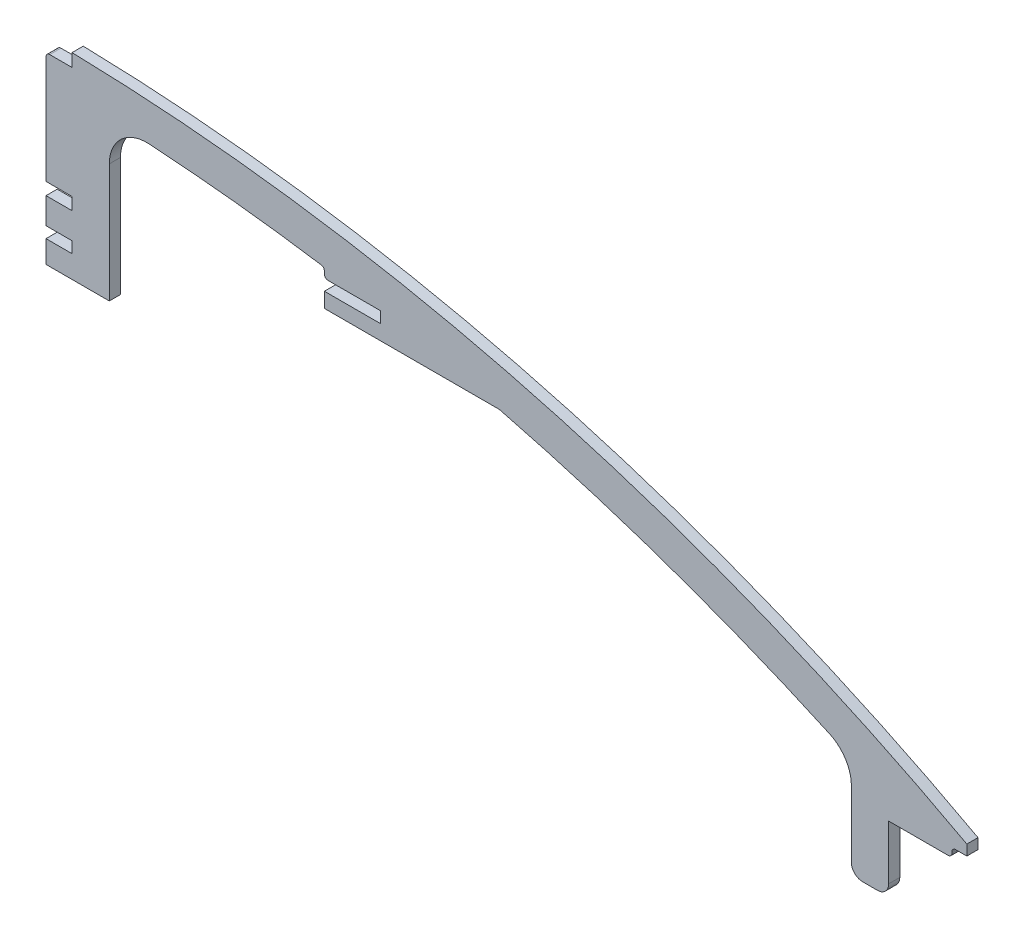
from build123d import *

# Parameters (mm, degrees)
BOSS_EXTRUDE1_DEPTH = 1.5
SKETCH4_W           = 2
SKETCH4_H           = 7.019019915
CUT_EXTRUDE2_DEPTH  = 3


with BuildPart() as part:
    # Sketch2 → Boss-Extrude1 (new, symmetric)
    with BuildSketch(Plane.XY):
        with BuildLine():
            Line((294.5, -67.353443934), (299.5, -67.353443934))
            Line((299.5, -67.353443934), (299.5, -65.649534053))
            ThreePointArc((299.5, -65.649534053), (182.278534334, -18.599191723), (57.25, -0.641677179))
            Line((57.25, -0.641677179), (57.25, -4.102198064))
            Line((57.25, -4.102198064), (51.25, -4.102198064))
            ThreePointArc((51.25, -4.102198064), (50.542893219, -4.395091282), (50.25, -5.102198064))
            Line((50.25, -5.102198064), (50.25, -34.102198064))
            Line((50.25, -34.102198064), (57.25, -34.102198064))
            Line((57.25, -34.102198064), (57.25, -37.402198064))
            Line((57.25, -37.402198064), (50.25, -37.402198064))
            Line((50.25, -37.402198064), (50.25, -44.402198064))
            Line((50.25, -44.402198064), (57.25, -44.402198064))
            Line((57.25, -44.402198064), (57.25, -47.402198064))
            Line((57.25, -47.402198064), (50.25, -47.402198064))
            Line((50.25, -47.402198064), (50.25, -53.402198064))
            Line((50.25, -53.402198064), (67.25, -53.402198064))
            Line((67.25, -53.402198064), (67.25, -38.8))
            Line((67.25, -38.8), (67.25, -21.521364961))
            ThreePointArc((67.25, -21.521364961), (70.406305806, -14.230010507), (77.882769957, -11.541404932))
            ThreePointArc((77.882769957, -11.541404932), (101.0737918, -13.534149792), (124.152314439, -16.563393762))
            ThreePointArc((124.152314439, -16.563393762), (124.759050209, -16.900693759), (125, -17.551725847))
            Line((125, -17.551725847), (125, -18.257285386))
            ThreePointArc((125, -18.257285386), (125.292893219, -18.964392167), (126, -19.257285386))
            Line((126, -19.257285386), (140, -19.257285386))
            Line((140, -19.257285386), (140, -22.257285386))
            Line((140, -22.257285386), (125, -22.257285386))
            Line((125, -22.257285386), (125, -26.257285386))
            Line((125, -26.257285386), (171.998789441, -26.257285386))
            ThreePointArc((171.998789441, -26.257285386), (217.028547909, -39.800007252), (260.649793668, -57.357666027))
            ThreePointArc((260.649793668, -57.357666027), (264.911240595, -61.04755196), (266.5, -66.455974249))
            Line((266.5, -66.455974249), (266.5, -84.321193081))
            ThreePointArc((266.5, -84.321193081), (267.378679656, -86.442513425), (269.5, -87.321193081))
            Line((269.5, -87.321193081), (273.5, -87.321193081))
            ThreePointArc((273.5, -87.321193081), (275.621320344, -86.442513425), (276.5, -84.321193081))
            Line((276.5, -84.321193081), (276.5, -69.703443934))
            Line((276.5, -69.703443934), (292.5, -69.703443934))
            ThreePointArc((292.5, -69.703443934), (293.207106781, -69.410550715), (293.5, -68.703443934))
            Line((293.5, -68.703443934), (293.5, -68.353443934))
            ThreePointArc((293.5, -68.353443934), (293.792893219, -67.646337153), (294.5, -67.353443934))
        make_face()
    extrude(amount=BOSS_EXTRUDE1_DEPTH, both=True)

    # Sketch4 → Cut-Extrude2 (cut)
    with BuildSketch(Plane.XY.offset(-1.5)):
        with Locations((298.5, -66.105228371)):
            Rectangle(SKETCH4_W, SKETCH4_H)
    extrude(amount=CUT_EXTRUDE2_DEPTH, mode=Mode.SUBTRACT)


solid = part.part
